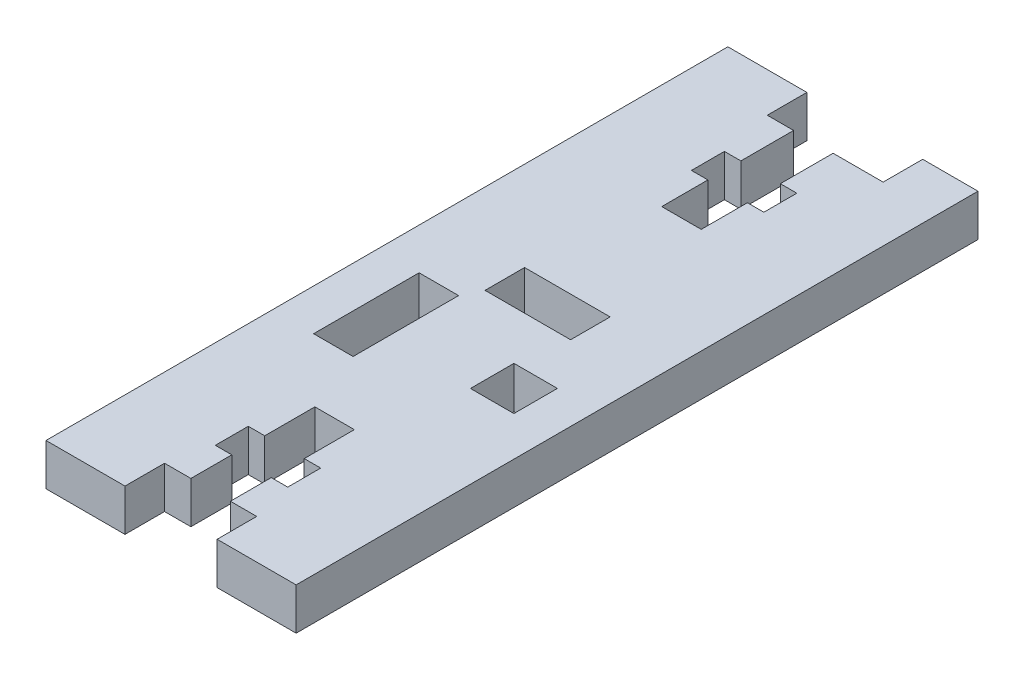
from build123d import *

# Parameters (mm, degrees)
SKETCH1_W           = 2.994660031
SKETCH1_H           = 8.000362858
SKETCH1_W_2         = 3.294225957
SKETCH1_H_2         = 3.300262419
SKETCH1_W_3         = 6.488474747
SKETCH1_H_3         = 2.999948682
BOSS_EXTRUDE1_DEPTH = 3.175


with BuildPart() as part:
    # Sketch1 → Boss-Extrude1 (new body)
    with BuildSketch(Plane(origin=(0, 0, 0), x_dir=(1, 0, 0), z_dir=(0, 1, 0))):
        Polygon((-3.134063131, -27.4833399), (-9.123310076, -27.4833399), (-9.123310076, 24.218538917), (-3.134063129, 24.218538917), (-3.134063129, 21.21845839), (-1.137605236, 21.21845839), (-1.137605236, 17.218250104), (-2.3854164, 17.218250104), (-2.3854164, 14.718365303), (-1.137605236, 14.718365303), (-1.137605236, 11.218216013), (1.857303385, 11.218216013), (1.857303385, 14.718365303), (3.105051182, 14.718365303), (3.105051182, 17.218250104), (1.857303385, 17.218250104), (1.857303385, 21.21845839), (5.650440312, 21.21845839), (5.650440312, 24.218538917), (9.842944855, 24.218538917), (9.842944855, -27.4833399), (3.853571177, -27.4833399), (3.853571177, -24.483195893), (1.857303382, -24.483195893), (1.857303382, -21.383140191), (3.10505118, -21.383140191), (3.10505118, -18.883001466), (1.857303382, -18.883001466), (1.857303382, -15.082802129), (-1.137605238, -15.082802129), (-1.137605238, -18.883001466), (-2.385416402, -18.883001466), (-2.385416402, -21.383140191), (-1.137605238, -21.383140191), (-1.137605238, -24.483195893), (-3.134063131, -24.483195893), align=None)
        with Locations((-4.490515563, -6.328244045)):
            Rectangle(SKETCH1_W, SKETCH1_H, mode=Mode.SUBTRACT)
        with Locations((5.201303454, -6.328244045)):
            Rectangle(SKETCH1_W_2, SKETCH1_H_2, mode=Mode.SUBTRACT)
        with Locations((0.908846113, 0.517732338)):
            Rectangle(SKETCH1_W_3, SKETCH1_H_3, mode=Mode.SUBTRACT)
    extrude(amount=BOSS_EXTRUDE1_DEPTH)


solid = part.part
